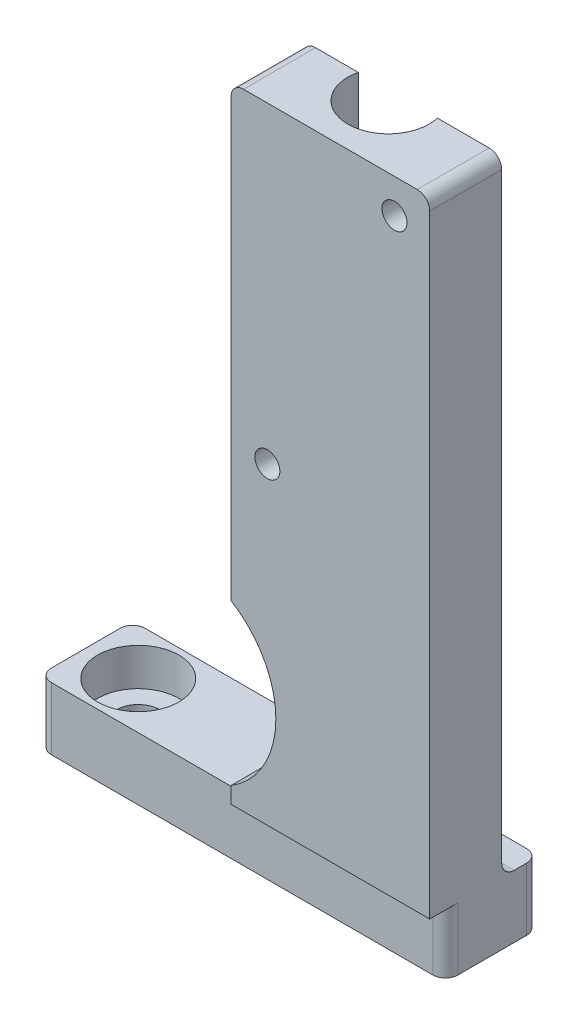
from build123d import *

# Parameters (mm, degrees)
BOSS_EXTRUDE1_DEPTH            = 8.75
M3_CLEARANCE_HOLE1_D           = 2
CUT_EXTRUDE2_REACH             = 66.481
SKETCH5_W                      = 1.25
SKETCH5_H                      = 5
SKETCH7_W                      = 15.88
SKETCH7_H                      = 3
CUT_EXTRUDE4_DEPTH             = 50
CBORE_FOR_M3_SHCS1_D           = 3.4
CBORE_FOR_M3_SHCS1_CBORE_D     = 6.5
CBORE_FOR_M3_SHCS1_CBORE_DEPTH = 3
FILLET1_R                      = 1
SKETCH12_R                     = 7.5
CUT_EXTRUDE5_DEPTH             = 5.75
CBORE_FOR_M3_SHCS2_D           = 3.4
CBORE_FOR_M3_SHCS2_CBORE_D     = 6.5
CBORE_FOR_M3_SHCS2_CBORE_DEPTH = 53


with BuildPart() as part:
    # Sketch1 → Boss-Extrude1 (new body)
    with BuildSketch(Plane.XY):
        Polygon((0, 0), (32.5, 0), (32.5, 4.239766082), (32.5, 55), (16.62, 55), (16.62, 5), (0, 5), align=None)
    extrude(amount=BOSS_EXTRUDE1_DEPTH)

    # M3 Clearance Hole1 (through all)
    with Locations(Plane.XY.offset(8.75)):
        with Locations((29.68, 52.275), (19.52, 30)):
            Hole(M3_CLEARANCE_HOLE1_D / 2)

    # Cut-Extrude2: up to this face of the body (flat: up to its plane)
    cut_extrude2_end = Plane(part.part.faces().sort_by_distance((32.5, 27.5, 4.375))[0])
    # Sketch5 → Cut-Extrude2 (cut, up to the picked face)
    with BuildSketch(Plane.ZY, mode=Mode.PRIVATE) as cut_extrude2_sk1:
        with Locations((8.125, 2.5)):
            Rectangle(SKETCH5_W, SKETCH5_H)
    cut_extrude2_tool1 = split(extrude(cut_extrude2_sk1.sketch, amount=-CUT_EXTRUDE2_REACH, mode=Mode.PRIVATE), bisect_by=cut_extrude2_end, keep=Keep.BOTH, mode=Mode.PRIVATE)
    add(cut_extrude2_tool1.solids().sort_by(Axis((0, 2.5, 8.125), (1, 0, 0)))[0], mode=Mode.SUBTRACT)

    # Sketch7 → Cut-Extrude4 (cut)
    with BuildSketch(Plane(origin=(0, 55, 0), x_dir=(1, 0, 0), z_dir=(0, 1, 0))):
        with Locations((24.56, -1.5)):
            Rectangle(SKETCH7_W, SKETCH7_H)
    extrude(amount=-CUT_EXTRUDE4_DEPTH, mode=Mode.SUBTRACT)

    # CBORE for M3 SHCS1 (through all)
    with Locations(Plane(origin=(0, 5, 0), x_dir=(1, 0, 0), z_dir=(0, 1, 0))):
        with Locations((4.2, -3.75)):
            CounterBoreHole(CBORE_FOR_M3_SHCS1_D / 2, CBORE_FOR_M3_SHCS1_CBORE_D / 2, CBORE_FOR_M3_SHCS1_CBORE_DEPTH)

    # Fillet1
    fillet1_edges = [part.edges().sort_by_distance(p)[0] for p in [
        (16.62, 55, 5.875),
        (32.5, 55, 5.875),
        (16.62, 5, 5.25),
        (0, 2.5, 7.5),
        (32.5, 2.5, 7.5),
        (24.56, 5, 3),
        (32.5, 2.5, 0),
        (0, 2.5, 0),
    ]]
    fillet(fillet1_edges, radius=FILLET1_R)

    # Sketch12 → Cut-Extrude5 (cut)
    with BuildSketch(Plane.XY.offset(8.75)):
        with Locations((12.7, 12.7)):
            Circle(SKETCH12_R)
    extrude(amount=-CUT_EXTRUDE5_DEPTH, mode=Mode.SUBTRACT)

    # CBORE for M3 SHCS2 (through all)
    with Locations(Plane(origin=(0, 55, 0), x_dir=(1, 0, 0), z_dir=(0, 1, 0))):
        with Locations((24.2, -3.75)):
            CounterBoreHole(CBORE_FOR_M3_SHCS2_D / 2, CBORE_FOR_M3_SHCS2_CBORE_D / 2, CBORE_FOR_M3_SHCS2_CBORE_DEPTH)


solid = part.part
